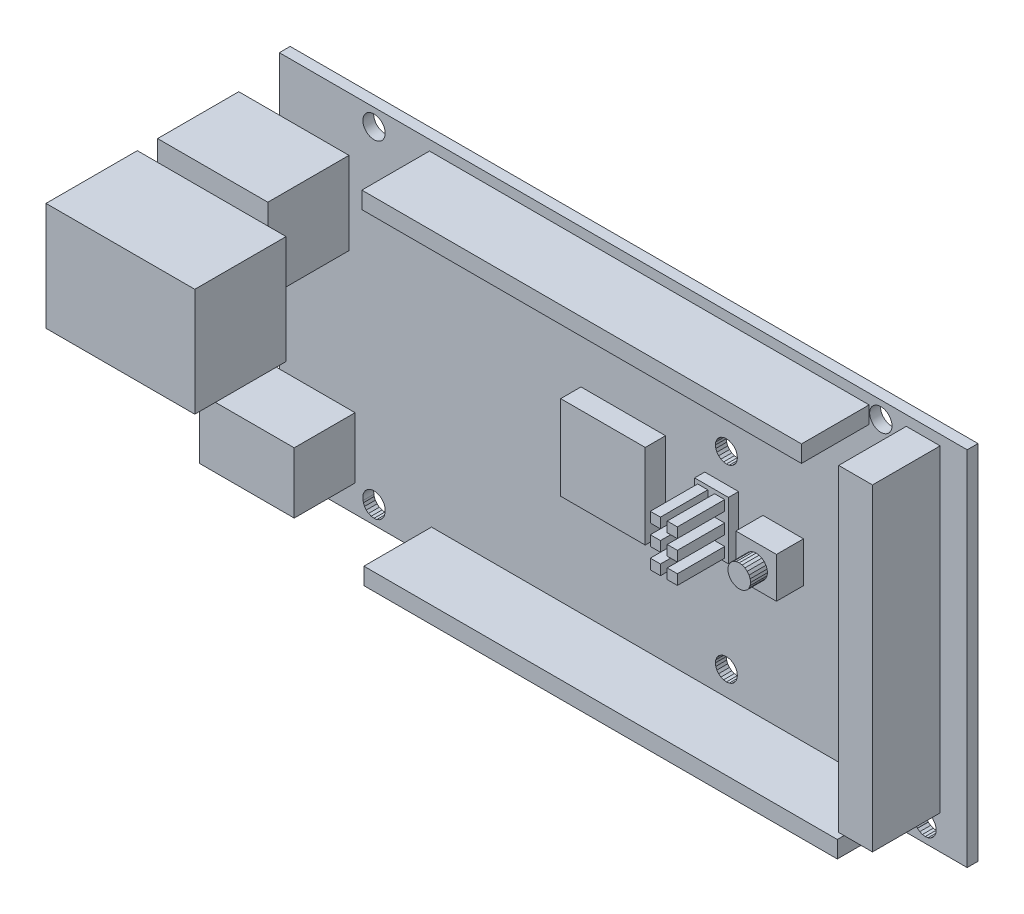
from build123d import *

# Parameters (mm, degrees)
SKETCH_1_W          = 101.700000464
SKETCH_1_H          = 53.500000388
EXTRUDE_1_DEPTH     = 1.59999996
SKETCH_2_W          = 16.30000025
SKETCH_2_H          = 12.200000696
EXTRUDE_2_DEPTH     = 12.000000221
SKETCH_3_W          = 13.999998569
SKETCH_3_H          = 8.999999613
EXTRUDE_3_DEPTH     = 8.999999729
CUT_EXTRUDE_2_DEPTH = 65.284097205
CUT_EXTRUDE_4_DEPTH = 65.284097205
CUT_EXTRUDE_5_DEPTH = 65.284097205
CUT_EXTRUDE_6_DEPTH = 64.96471804
SKETCH_10_W         = 6.000000984
SKETCH_10_H         = 6.000000052
EXTRUDE_4_DEPTH     = 3.999999841
EXTRUDE_5_DEPTH     = 2.50000041
CUT_EXTRUDE_7_DEPTH = 10.99999994
EXTRUDE_6_DEPTH     = 10.99999994
SKETCH_14_W         = 4.999999889
SKETCH_14_H         = 8.499999996
EXTRUDE_7_DEPTH     = 1.500000129
SKETCH_15_W         = 1.500000246
SKETCH_15_H         = 1.500000013
EXTRUDE_8_DEPTH     = 6.999999518
SKETCH_16_W         = 1.500000246
SKETCH_16_H         = 1.49999978
EXTRUDE_9_DEPTH     = 6.999999518
SKETCH_17_W         = 1.500000246
SKETCH_17_H         = 1.49999978
EXTRUDE_10_DEPTH    = 6.999999518
SKETCH_18_W         = 1.500000246
SKETCH_18_H         = 1.500000013
EXTRUDE_11_DEPTH    = 6.999999518
SKETCH_19_W         = 65.000001341
SKETCH_19_H         = 2.500001341
EXTRUDE_12_DEPTH    = 9.999999893
SKETCH_20_W         = 1.500000246
SKETCH_20_H         = 1.500000013
EXTRUDE_13_DEPTH    = 6.999999518
SKETCH_21_W         = 1.500000246
SKETCH_21_H         = 1.500000013
EXTRUDE_14_DEPTH    = 6.999999518
SKETCH_22_W         = 70.000000298
SKETCH_22_H         = 2.500001341
EXTRUDE_15_DEPTH    = 9.999999893
SKETCH_23_W         = 10.000000009
SKETCH_23_H         = 10.000000708
CUT_EXTRUDE_8_DEPTH = 12.000001967
SKETCH_24_W         = 4.999999423
SKETCH_24_H         = 4.999999888
EXTRUDE_16_DEPTH    = 12.000001967
SKETCH_25_W         = 12.500000186
SKETCH_25_H         = 12.500000186
EXTRUDE_17_DEPTH    = 3.000000142
SKETCH_26_W         = 4.999998957
SKETCH_26_H         = 47.000000253
EXTRUDE_18_DEPTH    = 9.999999893
SKETCH_27_R         = 1.65
CUT_EXTRUDE_9_DEPTH = 65.284097205
BOSS_EXTRUDE1_START = 5.5
SKETCH1_W           = 22
SKETCH1_H           = 16
BOSS_EXTRUDE1_DEPTH = 13.5
SKETCH2_W           = 6.2
SKETCH2_H           = 11.2
SKETCH2_W_2         = 2.945652648
SKETCH2_H_2         = 6.4
CUT_EXTRUDE1_DEPTH  = 13.5


with BuildPart() as part:
    # Эскиз1 → Бобышка-Вытянуть1 (new body)
    with BuildSketch(Plane(origin=(0, 0, 0), x_dir=(-1, 0, 0), z_dir=(0, 0, -1))):
        Rectangle(SKETCH_1_W, SKETCH_1_H)
    extrude(amount=-EXTRUDE_1_DEPTH)

    # Эскиз2 → Бобышка-Вытянуть2 (add)
    with BuildSketch(Plane.XY.offset(1.59999996)):
        with Locations((-48.700001091, 12.650000397)):
            Rectangle(SKETCH_2_W, SKETCH_2_H)
    extrude(amount=EXTRUDE_2_DEPTH)

    # Эскиз3 → Бобышка-Вытянуть3 (add)
    with BuildSketch(Plane.XY.offset(1.59999996)):
        with Locations((-46.649999917, -18.249999732)):
            Rectangle(SKETCH_3_W, SKETCH_3_H)
    extrude(amount=EXTRUDE_3_DEPTH)

    # Эскиз5 → Вырез-Вытянуть2 (cut, through all)
    with BuildSketch(Plane(origin=(0, 0, 0), x_dir=(-1, 0, 0), z_dir=(0, 0, -1))):
        Polygon((-16.657289118, -19.962500781), (-16.399050131, -20.299049094), (-16.062499955, -20.557289943), (-15.670580789, -20.719630644), (-15.250000171, -20.774999633), (-14.829419553, -20.719630644), (-14.437500387, -20.557289943), (-14.100950211, -20.299049094), (-13.842710294, -19.962500781), (-13.680369593, -19.570579752), (-13.624999672, -19.150000066), (-13.680369593, -18.729420379), (-13.842710294, -18.33749935), (-14.100950211, -18.000949174), (-14.437500387, -17.742710188), (-14.829419553, -17.580369487), (-15.250000171, -17.525000498), (-15.670580789, -17.580369487), (-16.062499955, -17.742710188), (-16.399050131, -18.000949174), (-16.657289118, -18.33749935), (-16.819629818, -18.729420379), (-16.875000671, -19.150000066), (-16.819629818, -19.570579752), align=None)
    extrude(amount=-CUT_EXTRUDE_2_DEPTH, mode=Mode.SUBTRACT)

    # Эскиз7 → Вырез-Вытянуть4 (cut, through all)
    with BuildSketch(Plane(origin=(0, 0, 0), x_dir=(-1, 0, 0), z_dir=(0, 0, -1))):
        Polygon((-43.500948697, -23.100949824), (-43.837498873, -22.842710838), (-44.229421765, -22.680370137), (-44.649999589, -22.624999285), (-45.070581138, -22.680370137), (-45.462500304, -22.842710838), (-45.79905048, -23.100949824), (-46.057291329, -23.4375), (-46.219628304, -23.829419166), (-46.275001019, -24.250000715), (-46.219628304, -24.670580402), (-46.057291329, -25.062499568), (-45.79905048, -25.399049744), (-45.462500304, -25.657290593), (-45.070581138, -25.819629431), (-44.649999589, -25.875000283), (-44.229421765, -25.819629431), (-43.837498873, -25.657290593), (-43.500948697, -25.399049744), (-43.242711574, -25.062499568), (-43.080370873, -24.670580402), (-43.024998158, -24.250000715), (-43.080370873, -23.829419166), (-43.242711574, -23.4375), align=None)
    extrude(amount=-CUT_EXTRUDE_4_DEPTH, mode=Mode.SUBTRACT)

    # Эскиз8 → Вырез-Вытянуть5 (cut, through all)
    with BuildSketch(Plane(origin=(0, 0, 0), x_dir=(-1, 0, 0), z_dir=(0, 0, -1))):
        Polygon((-16.399050131, 9.899049066), (-16.657289118, 9.562499821), (-16.819629818, 9.170580655), (-16.875000671, 8.750000037), (-16.819629818, 8.329419419), (-16.657289118, 7.937500253), (-16.399050131, 7.600951008), (-16.062499955, 7.342709228), (-15.670580789, 7.180370856), (-15.250000171, 7.125000004), (-14.829419553, 7.180370856), (-14.437500387, 7.342709228), (-14.100950211, 7.600951008), (-13.842710294, 7.937500253), (-13.680369593, 8.329419419), (-13.624999672, 8.750000037), (-13.680369593, 9.170580655), (-13.842710294, 9.562499821), (-14.100950211, 9.899049066), (-14.437500387, 10.157289915), (-14.829419553, 10.319629684), (-15.250000171, 10.374999605), (-15.670580789, 10.319629684), (-16.062499955, 10.157289915), align=None)
    extrude(amount=-CUT_EXTRUDE_5_DEPTH, mode=Mode.SUBTRACT)

    # Эскиз9 → Вырез-Вытянуть6 (cut, through all)
    with BuildSketch(Plane.XY.offset(1.59999996)):
        Polygon((-35.280369222, -24.670580402), (-35.225000232, -24.250000715), (-35.280369222, -23.829419166), (-35.442709923, -23.4375), (-35.700950772, -23.100949824), (-36.037500948, -22.842710838), (-36.429420114, -22.680370137), (-36.850001663, -22.624999285), (-37.270579487, -22.680370137), (-37.662498653, -22.842710838), (-37.999048829, -23.100949824), (-38.257289678, -23.4375), (-38.419630378, -23.829419166), (-38.474999368, -24.250000715), (-38.419630378, -24.670580402), (-38.257289678, -25.062499568), (-37.999048829, -25.399049744), (-37.662498653, -25.657290593), (-37.270579487, -25.819629431), (-36.850001663, -25.875000283), (-36.429420114, -25.819629431), (-36.037500948, -25.657290593), (-35.700950772, -25.399049744), (-35.442709923, -25.062499568), align=None)
    extrude(amount=-CUT_EXTRUDE_6_DEPTH, mode=Mode.SUBTRACT)

    # Эскиз10 → Бобышка-Вытянуть4 (add)
    with BuildSketch(Plane.XY.offset(1.59999996)):
        with Locations((23.649999872, 0.250000041)):
            Rectangle(SKETCH_10_W, SKETCH_10_H)
    extrude(amount=EXTRUDE_4_DEPTH)

    # Эскиз11 → Бобышка-Вытянуть5 (add)
    with BuildSketch(Plane.XY.offset(5.5999998)):
        Polygon((25.267930701, 0.68352191), (25.325000286, 0.250000012), (25.267930701, -0.183521901), (25.100590661, -0.587499992), (24.834400043, -0.934403914), (24.487499148, -1.20059296), (24.083519354, -1.367926016), (23.649999872, -1.425000024), (23.216480389, -1.367926016), (22.812500596, -1.20059296), (22.465599701, -0.934403914), (22.199409083, -0.587499992), (22.032070905, -0.183521901), (21.974999458, 0.250000012), (22.032070905, 0.68352191), (22.199409083, 1.087500015), (22.465599701, 1.434404054), (22.812500596, 1.700593042), (23.216480389, 1.867925981), (23.649999872, 1.92499999), (24.083519354, 1.867925981), (24.487499148, 1.700593042), (24.834400043, 1.434404054), (25.100590661, 1.087500015), align=None)
    extrude(amount=EXTRUDE_5_DEPTH)

    # Эскиз12 → Вырез-Вытянуть7 (cut)
    with BuildSketch(Plane.ZY.offset(53.649999201)):
        Polygon((7.951374166, -21.220250055), (8.511384018, -20.786769688), (8.972671814, -20.249439403), (9.316352196, -19.63024959), (9.528354742, -18.954539672), (9.600000456, -18.249999732), (9.528354742, -17.545459792), (9.316352196, -16.869749874), (8.972671814, -16.25056006), (8.511384018, -15.713229775), (7.951374166, -15.27975034), (7.31556816, -14.967869967), (6.629996933, -14.790359885), (5.922728218, -14.754489996), (5.222715903, -14.861729927), (4.558620043, -15.107680112), (3.957629204, -15.482280403), (3.444347065, -15.9702003), (3.039787058, -16.551440582), (2.760512987, -17.20223017), (2.61795707, -17.895910889), (2.61795707, -18.604090437), (2.760512987, -19.297769293), (3.039787058, -19.948560745), (3.444347065, -20.529799163), (3.957629204, -21.017720923), (4.558620043, -21.392319351), (5.222715903, -21.638270468), (5.922728218, -21.745510399), (6.629996933, -21.709639579), (7.31556816, -21.532129496), align=None)
    extrude(amount=-CUT_EXTRUDE_7_DEPTH, mode=Mode.SUBTRACT)

    # Эскиз13 → Бобышка-Вытянуть6 (add)
    with BuildSketch(Plane.ZY.offset(42.649999261)):
        Polygon((7.600000128, -18.249999732), (7.548889145, -18.63823086), (7.399037946, -18.999999389), (7.160659879, -19.31066066), (6.850000005, -19.549040124), (6.488229148, -19.698889926), (6.099999882, -19.750000909), (5.711771082, -19.698889926), (5.350000225, -19.549040124), (5.039339885, -19.31066066), (4.800961819, -18.999999389), (4.651111085, -18.63823086), (4.600000102, -18.249999732), (4.651111085, -17.861770466), (4.800961819, -17.500000075), (5.039339885, -17.189340666), (5.350000225, -16.95095934), (5.711771082, -16.801109537), (6.099999882, -16.750000417), (6.488229148, -16.801109537), (6.850000005, -16.95095934), (7.160659879, -17.189340666), (7.399037946, -17.500000075), (7.548889145, -17.861770466), align=None)
    extrude(amount=EXTRUDE_6_DEPTH)

    # Эскиз14 → Бобышка-Вытянуть7 (add)
    with BuildSketch(Plane.XY.offset(1.59999996)):
        with Locations((14.549999963, 0.249999808)):
            Rectangle(SKETCH_14_W, SKETCH_14_H)
    extrude(amount=EXTRUDE_7_DEPTH)

    # Эскиз15 → Бобышка-Вытянуть8 (add)
    with BuildSketch(Plane.XY.offset(3.100000089)):
        with Locations((15.749999788, 0.20000001)):
            Rectangle(SKETCH_15_W, SKETCH_15_H)
    extrude(amount=EXTRUDE_8_DEPTH)

    # Эскиз16 → Бобышка-Вытянуть9 (add)
    with BuildSketch(Plane.XY.offset(3.100000089)):
        with Locations((15.749999788, 3.199999919)):
            Rectangle(SKETCH_16_W, SKETCH_16_H)
    extrude(amount=EXTRUDE_9_DEPTH)

    # Эскиз17 → Бобышка-Вытянуть10 (add)
    with BuildSketch(Plane.XY.offset(3.100000089)):
        with Locations((13.250000309, 3.199999919)):
            Rectangle(SKETCH_17_W, SKETCH_17_H)
    extrude(amount=EXTRUDE_10_DEPTH)

    # Эскиз18 → Бобышка-Вытянуть11 (add)
    with BuildSketch(Plane.XY.offset(3.100000089)):
        with Locations((13.250000309, 0.20000001)):
            Rectangle(SKETCH_18_W, SKETCH_18_H)
    extrude(amount=EXTRUDE_11_DEPTH)

    # Эскиз19 → Бобышка-Вытянуть12 (add)
    with BuildSketch(Plane.XY.offset(1.59999996)):
        with Locations((3.84999998, 24.000000209)):
            Rectangle(SKETCH_19_W, SKETCH_19_H)
    extrude(amount=EXTRUDE_12_DEPTH)

    # Эскиз20 → Бобышка-Вытянуть13 (add)
    with BuildSketch(Plane.XY.offset(3.100000089)):
        with Locations((13.250000309, -2.800000017)):
            Rectangle(SKETCH_20_W, SKETCH_20_H)
    extrude(amount=EXTRUDE_13_DEPTH)

    # Эскиз21 → Бобышка-Вытянуть14 (add)
    with BuildSketch(Plane.XY.offset(3.100000089)):
        with Locations((15.749999788, -2.800000017)):
            Rectangle(SKETCH_21_W, SKETCH_21_H)
    extrude(amount=EXTRUDE_14_DEPTH)

    # Эскиз22 → Бобышка-Вытянуть15 (add)
    with BuildSketch(Plane.XY.offset(1.59999996)):
        with Locations((6.650000811, -24.000000209)):
            Rectangle(SKETCH_22_W, SKETCH_22_H)
    extrude(amount=EXTRUDE_15_DEPTH)

    # Эскиз23 → Вырез-Вытянуть8 (cut)
    with BuildSketch(Plane.ZY.offset(56.850001216)):
        with Locations((7.600000012, 12.650000397)):
            Rectangle(SKETCH_23_W, SKETCH_23_H)
    extrude(amount=-CUT_EXTRUDE_8_DEPTH, mode=Mode.SUBTRACT)

    # Эскиз24 → Бобышка-Вытянуть16 (add)
    with BuildSketch(Plane.ZY.offset(44.849999249)):
        with Locations((7.599999896, 12.650000397)):
            Rectangle(SKETCH_24_W, SKETCH_24_H)
    extrude(amount=EXTRUDE_16_DEPTH)

    # Эскиз25 → Бобышка-Вытянуть17 (add)
    with BuildSketch(Plane.XY.offset(1.59999996)):
        Rectangle(SKETCH_25_W, SKETCH_25_H)
    extrude(amount=EXTRUDE_17_DEPTH)

    # Эскиз26 → Бобышка-Вытянуть18 (add)
    with BuildSketch(Plane.XY.offset(1.59999996)):
        with Locations((44.350000099, 1.750000753)):
            Rectangle(SKETCH_26_W, SKETCH_26_H)
    extrude(amount=EXTRUDE_18_DEPTH)

    # Эскиз27 → Вырез-Вытянуть9 (cut, through all)
    with BuildSketch(Plane(origin=(0, 0, 0), x_dir=(-1, 0, 0), z_dir=(0, 0, -1))):
        with Locations((-44.429998913, -24.00999879)):
            Circle(SKETCH_27_R)
        with Locations((36.850001087, 24.25000121)):
            Circle(SKETCH_27_R)
        with Locations((-38.079998913, 24.25000121)):
            Circle(SKETCH_27_R)
        with Locations((36.850001087, -24.00999879)):
            Circle(SKETCH_27_R)
    extrude(amount=-CUT_EXTRUDE_9_DEPTH, mode=Mode.SUBTRACT)


with BuildPart() as body_2:
    # Sketch1 → Boss-Extrude1 (new body)
    with BuildSketch(Plane.XY.offset(13.60000018).offset(BOSS_EXTRUDE1_START)):
        with Locations((-43.350001216, 13.200000745)):
            Rectangle(SKETCH1_W, SKETCH1_H)
    extrude(amount=BOSS_EXTRUDE1_DEPTH)

    # Sketch2 → Cut-Extrude1 (cut)
    with BuildSketch(Plane.ZY.offset(54.350001216)):
        with Locations((26.80000018, 13.000000745)):
            Rectangle(SKETCH2_W, SKETCH2_H)
        with Locations((22.227173856, 13.200000745)):
            Rectangle(SKETCH2_W_2, SKETCH2_H_2)
    extrude(amount=-CUT_EXTRUDE1_DEPTH, mode=Mode.SUBTRACT)


solid = Compound([part.part, body_2.part])
